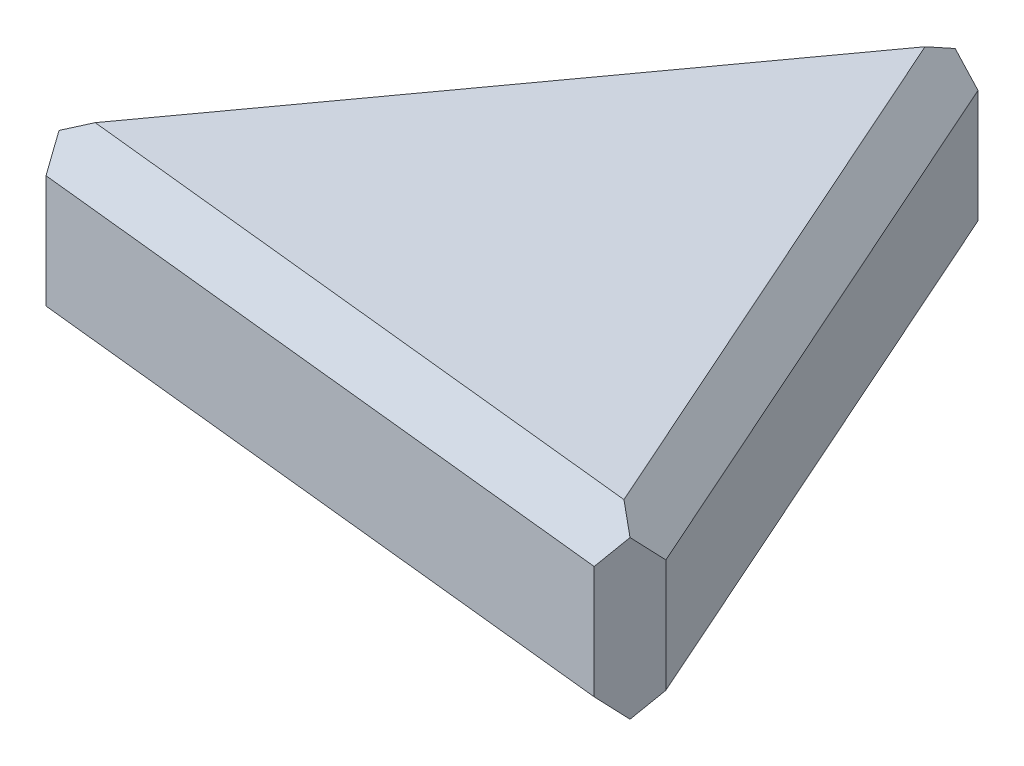
from build123d import *

# Parameters (mm, degrees)
BOSS_EXTRU_1_DEPTH = 36
CHANFREIN1_SIZE    = 7
CHANFREIN2_SIZE    = 10


with BuildPart() as part:
    # Esquisse1 → Boss.-Extru.1 (new body)
    with BuildSketch(Plane(origin=(0, 0, 0), x_dir=(1, 0, 0), z_dir=(0, 1, 0))):
        Polygon((43.253574696, -35.237781767), (-13.693473115, 92.656837923), (-95.979938868, -20.608061997), align=None)
    extrude(amount=BOSS_EXTRU_1_DEPTH)

    # Chanfrein1
    chanfrein1_edges = [part.edges().sort_by_distance(p)[0] for p in [
        (-54.836705991, 36, -36.024387963),
        (-54.836705991, 0, -36.024387963),
        (-26.363182086, 36, 27.922921882),
        (14.780050791, 0, -28.709528078),
        (-26.363182086, 0, 27.922921882),
        (14.780050791, 36, -28.709528078),
    ]]
    chamfer(chanfrein1_edges, length=CHANFREIN1_SIZE)

    # Chanfrein2
    chanfrein2_edges = [part.edges().sort_by_distance(p)[0] for p in [
        (-13.693473115, 18, -92.656837923),
        (43.253574696, 18, 35.237781767),
        (-95.979938868, 18, 20.608061997),
    ]]
    chamfer(chanfrein2_edges, length=CHANFREIN2_SIZE)


solid = part.part
